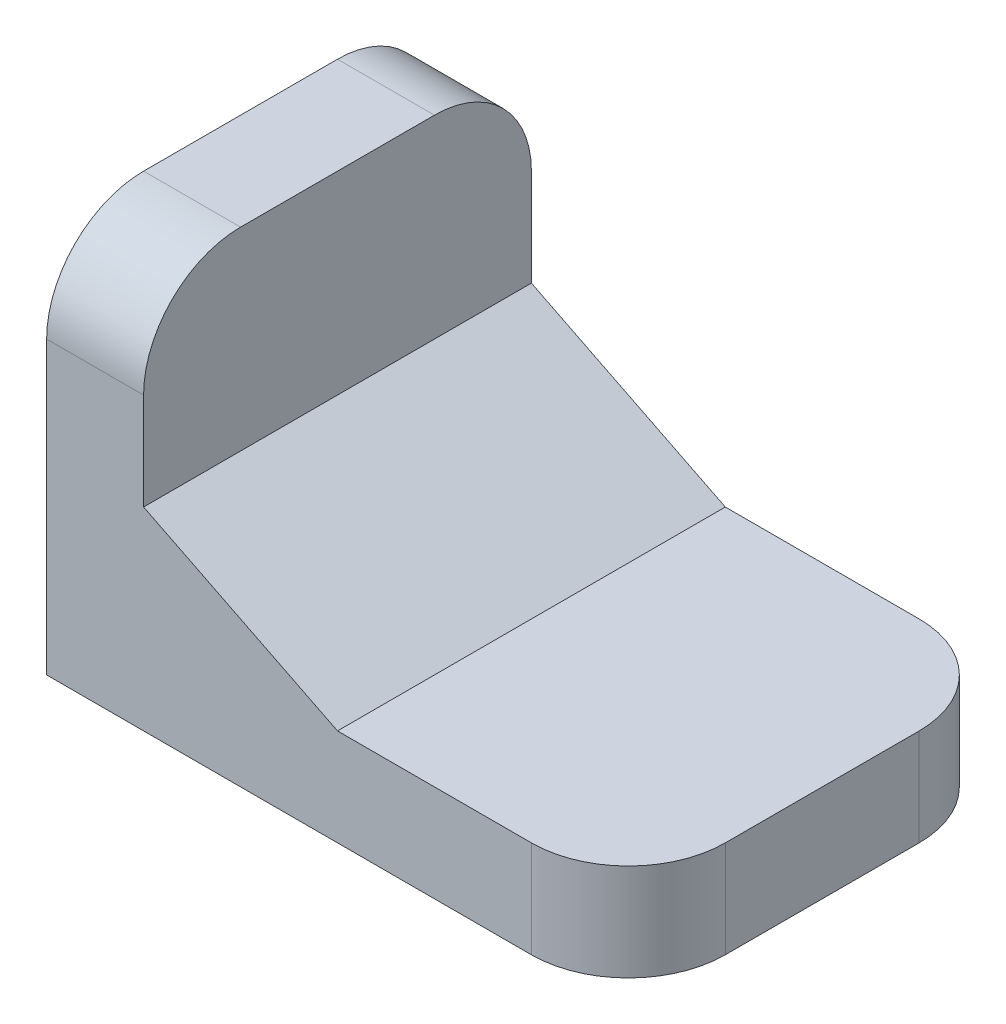
from build123d import *

# Parameters (mm, degrees)
BOSS_EXTRUDE1_DEPTH = 40
SKETCH2_OUTSIDE_W   = 58.492
SKETCH2_OUTSIDE_H   = 58.492
CUT_EXTRUDE1_DEPTH  = 40
SKETCH3_OUTSIDE_W   = 78.492
SKETCH3_OUTSIDE_H   = 58.492
CUT_EXTRUDE2_DEPTH  = 40


with BuildPart() as part:
    # Sketch1 → Boss-Extrude1 (new body)
    with BuildSketch(Plane.XY):
        Polygon((-47.538461538, 12.307692308), (-37.538461538, 12.307692308), (-37.538461538, -7.692307692), (-17.538461538, -17.692307692), (12.461538462, -17.692307692), (12.461538462, -27.692307692), (-47.538461538, -27.692307692), align=None)
    extrude(amount=BOSS_EXTRUDE1_DEPTH)

    # Sketch2 outside → Cut-Extrude1 (cut)
    with BuildSketch(Plane.ZY.offset(47.538461538)):
        with Locations((20, -7.692)):
            Rectangle(SKETCH2_OUTSIDE_W, SKETCH2_OUTSIDE_H)
        with BuildLine():
            Line((0, 2.307692308), (0, -27.692307692))
            Line((0, -27.692307692), (40, -27.692307692))
            Line((40, -27.692307692), (40, 2.307692308))
            ThreePointArc((40, 2.307692308), (37.071067812, 9.37876012), (30, 12.307692308))
            Line((30, 12.307692308), (10, 12.307692308))
            ThreePointArc((10, 12.307692308), (2.928932188, 9.37876012), (0, 2.307692308))
        make_face(mode=Mode.SUBTRACT)
    extrude(amount=-CUT_EXTRUDE1_DEPTH, mode=Mode.SUBTRACT)

    # Sketch3 outside → Cut-Extrude2 (cut)
    with BuildSketch(Plane.XZ.offset(27.692307692)):
        with Locations((-17.538, 20)):
            Rectangle(SKETCH3_OUTSIDE_W, SKETCH3_OUTSIDE_H)
        with BuildLine():
            Line((-47.538461538, 40), (2.461538462, 40))
            ThreePointArc((2.461538462, 40), (9.532606273, 37.071067812), (12.461538462, 30))
            Line((12.461538462, 30), (12.461538462, 10))
            ThreePointArc((12.461538462, 10), (9.532606273, 2.928932188), (2.461538462, 0))
            Line((2.461538462, 0), (-47.538461538, 0))
            Line((-47.538461538, 0), (-47.538461538, 40))
        make_face(mode=Mode.SUBTRACT)
    extrude(amount=-CUT_EXTRUDE2_DEPTH, mode=Mode.SUBTRACT)


solid = part.part
